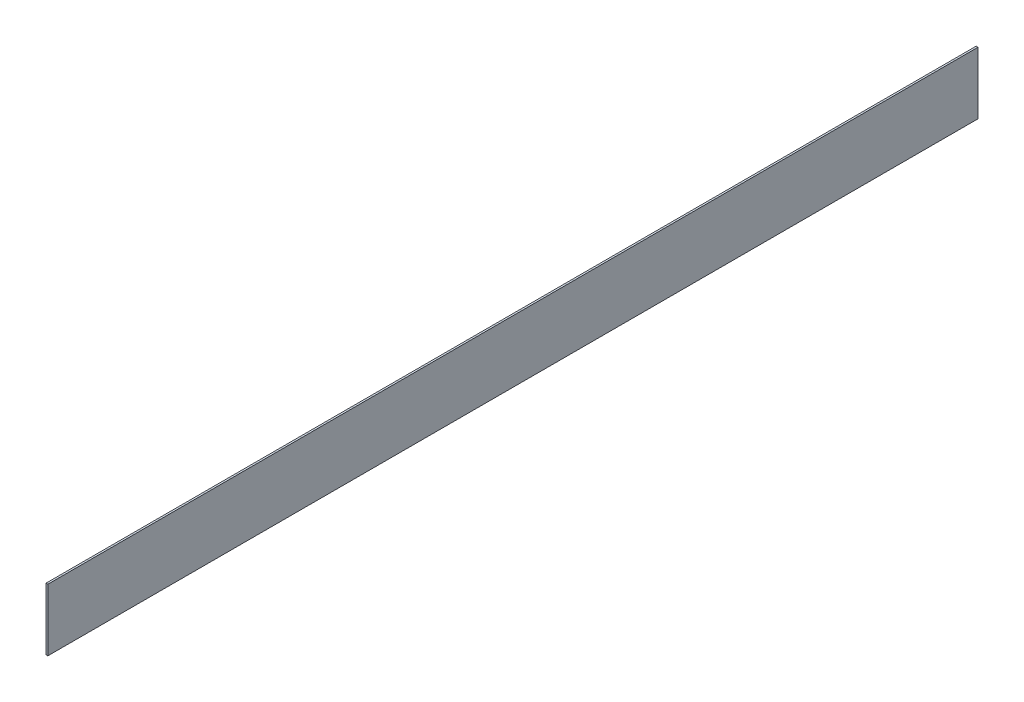
from build123d import *

# Parameters (mm, degrees)
SKETCH_1_W      = 12
SKETCH_1_H      = 400
EXTRUDE_1_DEPTH = 3000


with BuildPart() as part:
    # 草图1 → 凸台-拉伸1 (new, symmetric)
    with BuildSketch(Plane.XY):
        Rectangle(SKETCH_1_W, SKETCH_1_H)
    extrude(amount=EXTRUDE_1_DEPTH, both=True)


solid = part.part
